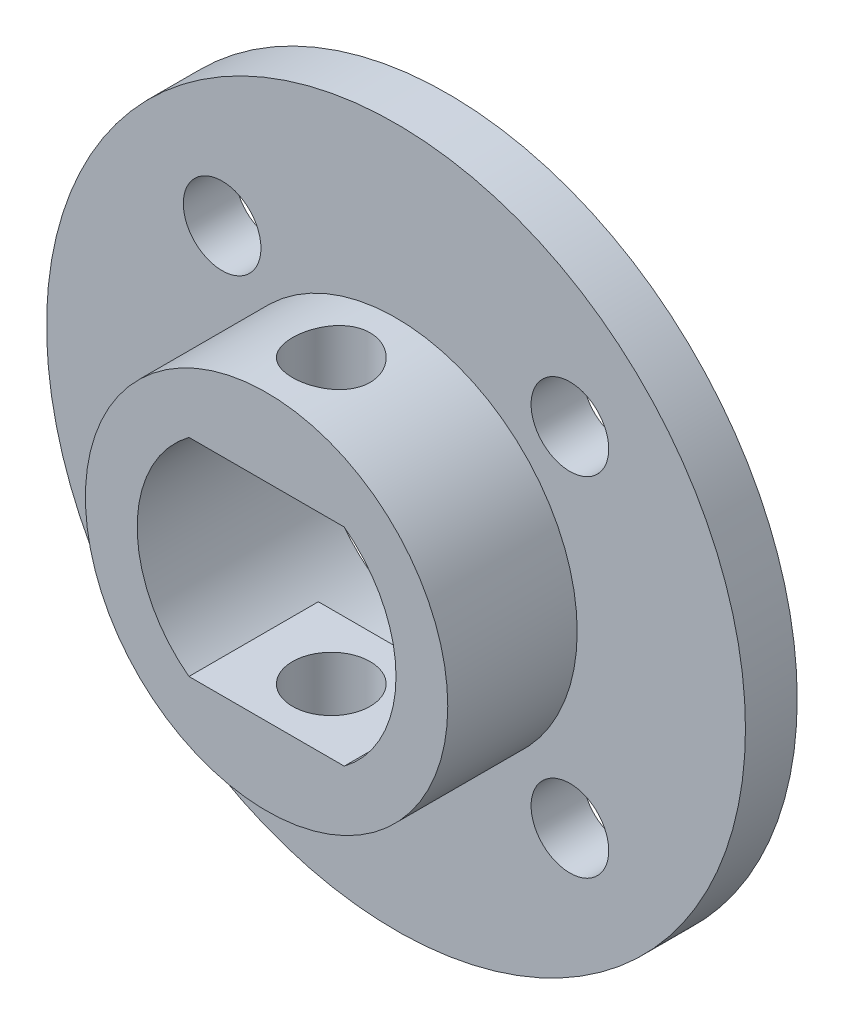
from build123d import *

# Parameters (mm, degrees)
SKETCH_1_R               = 13.5
SKETCH_1_R_2             = 1.5
EXTRUDE_1_DEPTH          = 2
SKETCH_2_R               = 7
EXTRUDE_2_DEPTH          = 5
CUT_EXTRUDE_1_DEPTH      = 21.334699408
CUT_EXTRUDE_2_DEPTH      = 24.184046239
CUT_EXTRUDE_2_DEPTH_BACK = 24.184046239
SKETCH_4_R               = 1.5
CUT_EXTRUDE_START        = -2
SKETCH_5_R               = 5
CUT_EXTRUDE_3_DEPTH      = 2


with BuildPart() as part:
    # 草图1 → 凸台-拉伸1 (new body)
    with BuildSketch(Plane.XY):
        Circle(SKETCH_1_R)
        with Locations((6.717514421, 6.717514421)):
            Circle(SKETCH_1_R_2, mode=Mode.SUBTRACT)
        with Locations((6.717514421, -6.717514421)):
            Circle(SKETCH_1_R_2, mode=Mode.SUBTRACT)
        with Locations((-6.717514421, -6.717514421)):
            Circle(SKETCH_1_R_2, mode=Mode.SUBTRACT)
        with Locations((-6.717514421, 6.717514421)):
            Circle(SKETCH_1_R_2, mode=Mode.SUBTRACT)
    extrude(amount=EXTRUDE_1_DEPTH)

    # 草图2 → 凸台-拉伸2 (add)
    with BuildSketch(Plane.XY.offset(2)):
        Circle(SKETCH_2_R)
    extrude(amount=EXTRUDE_2_DEPTH)

    # 草图3 → 切除-拉伸1 (cut, through all)
    with BuildSketch(Plane.XY.offset(7)):
        with BuildLine():
            Line((-3, 4), (3, 4))
            ThreePointArc((3, 4), (5, 0), (3, -4))
            Line((3, -4), (-3, -4))
            ThreePointArc((-3, -4), (-5, 0), (-3, 4))
        make_face()
    extrude(amount=-CUT_EXTRUDE_1_DEPTH, mode=Mode.SUBTRACT)

    # 草图4 → 切除-拉伸2 (cut, two sides: drawn at the far end of the back side and taken through both)
    with BuildSketch(Plane.XZ.offset(-4).offset(-CUT_EXTRUDE_2_DEPTH_BACK)):
        with Locations(Location((0, 4.5, 0), (0, 0, 270))):
            Circle(SKETCH_4_R)
    extrude(amount=CUT_EXTRUDE_2_DEPTH + CUT_EXTRUDE_2_DEPTH_BACK, mode=Mode.SUBTRACT)

    # 草图5 → 切除-拉伸3 (cut)
    with BuildSketch(Plane(origin=(0, 0, 0), x_dir=(-1, 0, 0), z_dir=(0, 0, -1)).offset(CUT_EXTRUDE_START)):
        with Locations(Location((0, 0, 0), (0, 0, 180))):
            Circle(SKETCH_5_R)
    extrude(amount=CUT_EXTRUDE_3_DEPTH, mode=Mode.SUBTRACT)


solid = part.part
